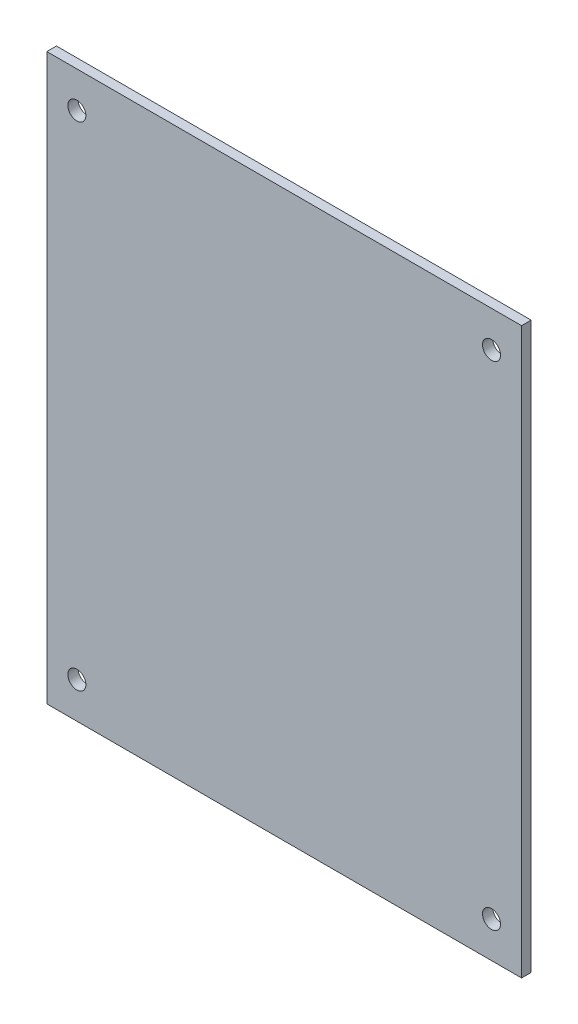
from build123d import *

# Parameters (mm, degrees)
SKETCH1_W           = 79
SKETCH1_H           = 94
SKETCH1_R           = 1.5
BOSS_EXTRUDE1_DEPTH = 1.6
BOSS_EXTRUDE2_START = -0.1
SKETCH2_R           = 5
SKETCH2_R_2         = 1.25
SKETCH2_R_3         = 4.5
SKETCH2_R_4         = 1.5
SKETCH2_W           = 0.889
SKETCH2_H           = 0.889
SKETCH2_W_2         = 19.5
SKETCH2_H_2         = 18
SKETCH2_W_3         = 7.5
SKETCH2_H_3         = 4.995279521
BOSS_EXTRUDE2_DEPTH = 0.1


with BuildPart() as part:
    # Sketch1 → Boss-Extrude1 (new body)
    with BuildSketch(Plane.XY):
        Rectangle(SKETCH1_W, SKETCH1_H)
        with Locations((-34.5, 41)):
            Circle(SKETCH1_R, mode=Mode.SUBTRACT)
        with Locations(Location((34.5, 41, 0), (0, 0, 180))):
            Circle(SKETCH1_R, mode=Mode.SUBTRACT)
        with Locations((34.5, -41)):
            Circle(SKETCH1_R, mode=Mode.SUBTRACT)
        with Locations(Location((-34.5, -41, 0), (0, 0, 180))):
            Circle(SKETCH1_R, mode=Mode.SUBTRACT)
    extrude(amount=BOSS_EXTRUDE1_DEPTH)

    # Sketch2 → Boss-Extrude2 (add)
    # profile 1 of 30: a face of its own
    with BuildSketch(Plane.XY.offset(BOSS_EXTRUDE2_START)):
        Circle(SKETCH2_R)
    # profile 2 of 30: a face of its own
    with BuildSketch(Plane.XY.offset(BOSS_EXTRUDE2_START)):
        with Locations((-16.086679272, 16.086679272)):
            Circle(SKETCH2_R_2)
    # profile 3 of 30: a face of its own
    with BuildSketch(Plane.XY.offset(BOSS_EXTRUDE2_START)):
        with Locations((16.086679272, 16.086679272)):
            Circle(SKETCH2_R_2)
    # profile 4 of 30: a face of its own
    with BuildSketch(Plane.XY.offset(BOSS_EXTRUDE2_START)):
        with Locations((32.5, 24.9)):
            Circle(SKETCH2_R_2)
    # profile 5 of 30: a face of its own
    with BuildSketch(Plane.XY.offset(BOSS_EXTRUDE2_START)):
        with Locations((16.086679272, -16.086679272)):
            Circle(SKETCH2_R_2)
    # profile 6 of 30: a face of its own
    with BuildSketch(Plane.XY.offset(BOSS_EXTRUDE2_START)):
        with Locations((32.5, -24.9)):
            Circle(SKETCH2_R_2)
    # profile 7 of 30: a face of its own
    with BuildSketch(Plane.XY.offset(BOSS_EXTRUDE2_START)):
        with Locations((-16.086679272, -16.086679272)):
            Circle(SKETCH2_R_2)
    # profile 8 of 30: a face of its own
    with BuildSketch(Plane.XY.offset(BOSS_EXTRUDE2_START)):
        with Locations((-34.5, 41)):
            Circle(SKETCH2_R_3)
        with Locations((-34.5, 41)):
            Circle(SKETCH2_R_4, mode=Mode.SUBTRACT)
    # profile 9 of 30: a face of its own
    with BuildSketch(Plane.XY.offset(BOSS_EXTRUDE2_START)):
        with Locations(Location((34.5, 41, 0), (0, 0, 180))):
            Circle(SKETCH2_R_3)
        with Locations(Location((34.5, 41, 0), (0, 0, 180))):
            Circle(SKETCH2_R_4, mode=Mode.SUBTRACT)
    # profile 10 of 30: a face of its own
    with BuildSketch(Plane.XY.offset(BOSS_EXTRUDE2_START)):
        with Locations(Location((-34.5, -41, 0), (0, 0, 180))):
            Circle(SKETCH2_R_3)
        with Locations(Location((-34.5, -41, 0), (0, 0, 180))):
            Circle(SKETCH2_R_4, mode=Mode.SUBTRACT)
    # profile 11 of 30: a face of its own
    with BuildSketch(Plane.XY.offset(BOSS_EXTRUDE2_START)):
        with Locations((34.5, -41)):
            Circle(SKETCH2_R_3)
        with Locations((34.5, -41)):
            Circle(SKETCH2_R_4, mode=Mode.SUBTRACT)
    # profile 12 of 30: a face of its own
    with BuildSketch(Plane.XY.offset(BOSS_EXTRUDE2_START)):
        with Locations((-3.72, 39.1133)):
            Rectangle(SKETCH2_W, SKETCH2_H)
    # profile 13 of 30: a face of its own
    with BuildSketch(Plane.XY.offset(BOSS_EXTRUDE2_START)):
        with Locations((-1.18, 39.1133)):
            Rectangle(SKETCH2_W, SKETCH2_H)
    # profile 14 of 30: a face of its own
    with BuildSketch(Plane.XY.offset(BOSS_EXTRUDE2_START)):
        with Locations((1.36, 39.1133)):
            Rectangle(SKETCH2_W, SKETCH2_H)
    # profile 15 of 30: a face of its own
    with BuildSketch(Plane.XY.offset(BOSS_EXTRUDE2_START)):
        with Locations((3.9, 39.1133)):
            Rectangle(SKETCH2_W, SKETCH2_H)
    # profile 16 of 30: a face of its own
    with BuildSketch(Plane.XY.offset(BOSS_EXTRUDE2_START)):
        with Locations((-3.72, 36.5733)):
            Rectangle(SKETCH2_W, SKETCH2_H)
    # profile 17 of 30: a face of its own
    with BuildSketch(Plane.XY.offset(BOSS_EXTRUDE2_START)):
        with Locations((-1.18, 36.5733)):
            Rectangle(SKETCH2_W, SKETCH2_H)
    # profile 18 of 30: a face of its own
    with BuildSketch(Plane.XY.offset(BOSS_EXTRUDE2_START)):
        with Locations((1.36, 36.5733)):
            Rectangle(SKETCH2_W, SKETCH2_H)
    # profile 19 of 30: a face of its own
    with BuildSketch(Plane.XY.offset(BOSS_EXTRUDE2_START)):
        with Locations((3.9, 36.5733)):
            Rectangle(SKETCH2_W, SKETCH2_H)
    # profile 20 of 30: a face of its own
    with BuildSketch(Plane.XY.offset(BOSS_EXTRUDE2_START)):
        with Locations((-3.72, 21.1133)):
            Rectangle(SKETCH2_W, SKETCH2_H)
    # profile 21 of 30: a face of its own
    with BuildSketch(Plane.XY.offset(BOSS_EXTRUDE2_START)):
        with Locations((-1.18, 21.1133)):
            Rectangle(SKETCH2_W, SKETCH2_H)
    # profile 22 of 30: a face of its own
    with BuildSketch(Plane.XY.offset(BOSS_EXTRUDE2_START)):
        with Locations((1.36, 21.1133)):
            Rectangle(SKETCH2_W, SKETCH2_H)
    # profile 23 of 30: a face of its own
    with BuildSketch(Plane.XY.offset(BOSS_EXTRUDE2_START)):
        with Locations((3.9, 21.1133)):
            Rectangle(SKETCH2_W, SKETCH2_H)
    # profile 24 of 30: a face of its own
    with BuildSketch(Plane.XY.offset(BOSS_EXTRUDE2_START)):
        with Locations((-3.72, 18.5733)):
            Rectangle(SKETCH2_W, SKETCH2_H)
    # profile 25 of 30: a face of its own
    with BuildSketch(Plane.XY.offset(BOSS_EXTRUDE2_START)):
        with Locations((-1.18, 18.5733)):
            Rectangle(SKETCH2_W, SKETCH2_H)
    # profile 26 of 30: a face of its own
    with BuildSketch(Plane.XY.offset(BOSS_EXTRUDE2_START)):
        with Locations((1.36, 18.5733)):
            Rectangle(SKETCH2_W, SKETCH2_H)
    # profile 27 of 30: a face of its own
    with BuildSketch(Plane.XY.offset(BOSS_EXTRUDE2_START)):
        with Locations((3.9, 18.5733)):
            Rectangle(SKETCH2_W, SKETCH2_H)
    # profile 28 of 30: a face of its own
    with BuildSketch(Plane.XY.offset(BOSS_EXTRUDE2_START)):
        with Locations((-29.75, 20.5)):
            Rectangle(SKETCH2_W_2, SKETCH2_H_2)
        with Locations((-32.5, 24.9)):
            Circle(SKETCH2_R_2, mode=Mode.SUBTRACT)
    # profile 29 of 30: a face of its own
    with BuildSketch(Plane.XY.offset(BOSS_EXTRUDE2_START)):
        with Locations((0, -44.502360239)):
            Rectangle(SKETCH2_W_3, SKETCH2_H_3)
    # profile 30 of 30: a face of its own
    with BuildSketch(Plane.XY.offset(BOSS_EXTRUDE2_START)):
        Polygon((-39.724379768, -12.8), (-22.135781761, -12.8), (-22.135781761, -28.8), (-39.499973122, -28.8), align=None)
        with Locations((-32.5, -24.9)):
            Circle(SKETCH2_R_2, mode=Mode.SUBTRACT)
    extrude(amount=BOSS_EXTRUDE2_DEPTH)


solid = part.part
